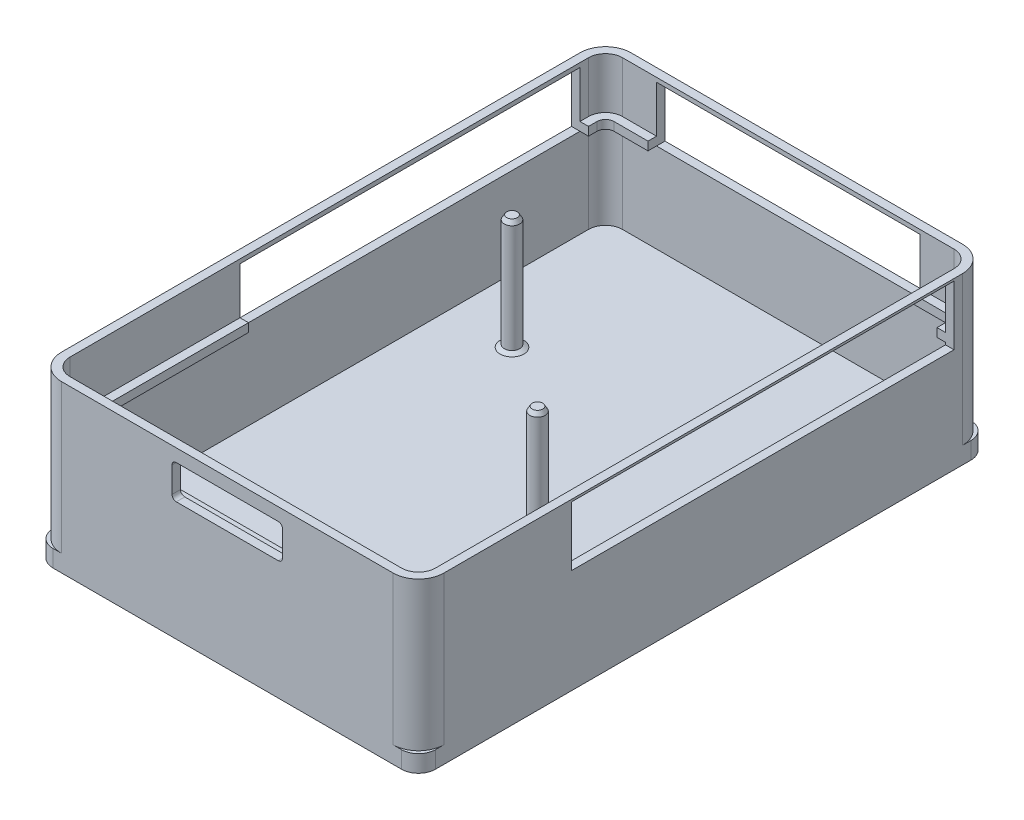
from build123d import *
from OCP.BRepFilletAPI import BRepFilletAPI_MakeChamfer

# Parameters (mm, degrees)
EXTRUDE_1_DEPTH     = 2
EXTRUDE_2_DEPTH     = 17.5
SKETCH_3_R          = 0.9
EXTRUDE_3_DEPTH     = 13.5
CHAMFER_2_SIZE      = 0.5
CHAMFER_2_SIZE2     = 0.288675135
CHAMFER_3_SIZE      = 0.5
CHAMFER_3_SIZE2     = 0.288675135
CHAMFER_4_SIZE      = 0.5
CHAMFER_4_SIZE2     = 0.288675135
EXTRUDE_5_DEPTH     = 1
CUT_EXTRUDE_1_REACH = 75.318
CUT_EXTRUDE_2_REACH = 61.393
SKETCH_7_W          = 45
SKETCH_7_H          = 7
CUT_EXTRUDE_3_REACH = 61.393
CUT_EXTRUDE_4_REACH = 75.318
SKETCH_9_W          = 31
SKETCH_9_H          = 6.5


with BuildPart() as part:
    # 草图1 → 凸台-拉伸1 (new body)
    with BuildSketch(Plane(origin=(0, 0, 0), x_dir=(1, 0, 0), z_dir=(0, 1, 0))):
        with BuildLine():
            Line((-22.5, 31.5), (-22.5, -31.5))
            ThreePointArc((-22.5, -31.5), (-21.914213562, -32.914213562), (-20.5, -33.5))
            Line((-20.5, -33.5), (20.5, -33.5))
            ThreePointArc((20.5, -33.5), (21.914213562, -32.914213562), (22.5, -31.5))
            Line((22.5, -31.5), (22.5, 31.5))
            ThreePointArc((22.5, 31.5), (21.914213562, 32.914213562), (20.5, 33.5))
            Line((20.5, 33.5), (-20.5, 33.5))
            ThreePointArc((-20.5, 33.5), (-21.914213562, 32.914213562), (-22.5, 31.5))
        make_face()
    extrude(amount=EXTRUDE_1_DEPTH)

    # 草图2 → 凸台-拉伸2 (add)
    with BuildSketch(Plane(origin=(0, 2, 0), x_dir=(1, 0, 0), z_dir=(0, 1, 0))):
        with BuildLine():
            Line((19.5, 33.5), (-19.5, 33.5))
            ThreePointArc((-19.5, 33.5), (-21.621320344, 32.621320344), (-22.5, 30.5))
            Line((-22.5, 30.5), (-22.5, -30.5))
            ThreePointArc((-22.5, -30.5), (-21.621320344, -32.621320344), (-19.5, -33.5))
            Line((-19.5, -33.5), (19.5, -33.5))
            ThreePointArc((19.5, -33.5), (21.621320344, -32.621320344), (22.5, -30.5))
            Line((22.5, -30.5), (22.5, 30.5))
            ThreePointArc((22.5, 30.5), (21.621320344, 32.621320344), (19.5, 33.5))
        make_face()
        with BuildLine():
            Line((-21.5, 30.5), (-21.5, -30.5))
            ThreePointArc((-21.5, -30.5), (-20.914213562, -31.914213562), (-19.5, -32.5))
            Line((-19.5, -32.5), (19.5, -32.5))
            ThreePointArc((19.5, -32.5), (20.914213562, -31.914213562), (21.5, -30.5))
            Line((21.5, -30.5), (21.5, 30.5))
            ThreePointArc((21.5, 30.5), (20.914213562, 31.914213562), (19.5, 32.5))
            Line((19.5, 32.5), (-19.5, 32.5))
            ThreePointArc((-19.5, 32.5), (-20.914213562, 31.914213562), (-21.5, 30.5))
        make_face(mode=Mode.SUBTRACT)
    extrude(amount=EXTRUDE_2_DEPTH)

    # 草图3 → 凸台-拉伸3 (add)
    with BuildSketch(Plane(origin=(0, 2, 0), x_dir=(1, 0, 0), z_dir=(0, 1, 0))):
        with Locations(Location((-14, 14, 0), (0, 0, 90))):
            Circle(SKETCH_3_R)
        with Locations(Location((7, -4, 0), (0, 0, 90))):
            Circle(SKETCH_3_R)
        with Locations(Location((-19, -30, 0), (0, 0, 90))):
            Circle(SKETCH_3_R)
    extrude(amount=EXTRUDE_3_DEPTH)

    # 倒角2: one chamfer whose edges measure the first distance from different faces: ONE call of the kernel's chamfer builder (chamfer() names one face for all edges)
    chamfer_2_edges_1 = [part.edges().sort_by_distance(p)[0] for p in [
        (-14, 2, -13.1),
    ]]
    chamfer_2_side_1 = [part.faces().sort_by_distance(p)[0] for p in [
        (0.023765643, 2, -0.018281264),
    ]]
    chamfer_2_edges_2 = [part.edges().sort_by_distance(p)[0] for p in [
        (-14, 15.5, -13.1),
    ]]
    chamfer_2_side_2 = [part.faces().sort_by_distance(p)[0] for p in [
        (-14, 8.75, -13.1),
    ]]
    chamfer_2 = BRepFilletAPI_MakeChamfer(part.part.solid().wrapped)
    for e in chamfer_2_edges_1:
        chamfer_2.Add(CHAMFER_2_SIZE, CHAMFER_2_SIZE2, e.wrapped, chamfer_2_side_1[0].wrapped)  # the first distance lies on this face
    for e in chamfer_2_edges_2:
        chamfer_2.Add(CHAMFER_2_SIZE, CHAMFER_2_SIZE2, e.wrapped, chamfer_2_side_2[0].wrapped)  # the first distance lies on this face
    add(Compound.cast(chamfer_2.Shape()), mode=Mode.REPLACE)

    # 倒角3: one chamfer whose edges measure the first distance from different faces: ONE call of the kernel's chamfer builder (chamfer() names one face for all edges)
    chamfer_3_edges_1 = [part.edges().sort_by_distance(p)[0] for p in [
        (7, 2, 4.9),
    ]]
    chamfer_3_side_1 = [part.faces().sort_by_distance(p)[0] for p in [
        (0.04198855, 2, -0.000112994),
    ]]
    chamfer_3_edges_2 = [part.edges().sort_by_distance(p)[0] for p in [
        (7, 15.5, 4.9),
    ]]
    chamfer_3_side_2 = [part.faces().sort_by_distance(p)[0] for p in [
        (7, 8.75, 4.9),
    ]]
    chamfer_3 = BRepFilletAPI_MakeChamfer(part.part.solid().wrapped)
    for e in chamfer_3_edges_1:
        chamfer_3.Add(CHAMFER_3_SIZE, CHAMFER_3_SIZE2, e.wrapped, chamfer_3_side_1[0].wrapped)  # the first distance lies on this face
    for e in chamfer_3_edges_2:
        chamfer_3.Add(CHAMFER_3_SIZE, CHAMFER_3_SIZE2, e.wrapped, chamfer_3_side_2[0].wrapped)  # the first distance lies on this face
    add(Compound.cast(chamfer_3.Shape()), mode=Mode.REPLACE)

    # 倒角4: one chamfer whose edges measure the first distance from different faces: ONE call of the kernel's chamfer builder (chamfer() names one face for all edges)
    chamfer_4_edges_1 = [part.edges().sort_by_distance(p)[0] for p in [
        (-19, 2, 30.9),
    ]]
    chamfer_4_side_1 = [part.faces().sort_by_distance(p)[0] for p in [
        (-19, 8.75, 30.9),
    ]]
    chamfer_4_edges_2 = [part.edges().sort_by_distance(p)[0] for p in [
        (-19, 15.5, 30.9),
    ]]
    chamfer_4_side_2 = [part.faces().sort_by_distance(p)[0] for p in [
        (-19, 15.5, 30),
    ]]
    chamfer_4 = BRepFilletAPI_MakeChamfer(part.part.solid().wrapped)
    for e in chamfer_4_edges_1:
        chamfer_4.Add(CHAMFER_4_SIZE, CHAMFER_4_SIZE2, e.wrapped, chamfer_4_side_1[0].wrapped)  # the first distance lies on this face
    for e in chamfer_4_edges_2:
        chamfer_4.Add(CHAMFER_4_SIZE, CHAMFER_4_SIZE2, e.wrapped, chamfer_4_side_2[0].wrapped)  # the first distance lies on this face
    add(Compound.cast(chamfer_4.Shape()), mode=Mode.REPLACE)

    # 草图6 → 凸台-拉伸5 (add)
    with BuildSketch(Plane(origin=(0, 12.5, 0), x_dir=(1, 0, 0), z_dir=(0, 1, 0))):
        with BuildLine():
            Line((-21.5, 30.5), (-21.5, -30.5))
            ThreePointArc((-21.5, -30.5), (-20.914213562, -31.914213562), (-19.5, -32.5))
            Line((-19.5, -32.5), (19.5, -32.5))
            ThreePointArc((19.5, -32.5), (20.914213562, -31.914213562), (21.5, -30.5))
            Line((21.5, -30.5), (21.5, 30.5))
            ThreePointArc((21.5, 30.5), (20.914213562, 31.914213562), (19.5, 32.5))
            Line((19.5, 32.5), (-19.5, 32.5))
            ThreePointArc((-19.5, 32.5), (-20.914213562, 31.914213562), (-21.5, 30.5))
        make_face()
        with BuildLine():
            Line((19.5, 31.5), (-19.5, 31.5))
            ThreePointArc((-19.5, 31.5), (-20.207106781, 31.207106781), (-20.5, 30.5))
            Line((-20.5, 30.5), (-20.5, -30.5))
            ThreePointArc((-20.5, -30.5), (-20.207106781, -31.207106781), (-19.5, -31.5))
            Line((-19.5, -31.5), (19.5, -31.5))
            ThreePointArc((19.5, -31.5), (20.207106781, -31.207106781), (20.5, -30.5))
            Line((20.5, -30.5), (20.5, 30.5))
            ThreePointArc((20.5, 30.5), (20.207106781, 31.207106781), (19.5, 31.5))
        make_face(mode=Mode.SUBTRACT)
    extrude(amount=EXTRUDE_5_DEPTH)

    # 草图4 → 切除-拉伸1 (cut, up to next)
    with BuildSketch(Plane.XY.offset(33.5), mode=Mode.PRIVATE) as cut_extrude_1_sk1:
        with BuildLine():
            Line((-6.5, 17.5), (-6.5, 14.5))
            ThreePointArc((-6.5, 14.5), (-6.353553391, 14.146446609), (-6, 14))
            Line((-6, 14), (6, 14))
            ThreePointArc((6, 14), (6.353553391, 14.146446609), (6.5, 14.5))
            Line((6.5, 14.5), (6.5, 17.5))
            ThreePointArc((6.5, 17.5), (6.353553391, 17.853553391), (6, 18))
            Line((6, 18), (-6, 18))
            ThreePointArc((-6, 18), (-6.353553391, 17.853553391), (-6.5, 17.5))
        make_face()
    cut_extrude_1_tool1 = extrude(cut_extrude_1_sk1.sketch, amount=-CUT_EXTRUDE_1_REACH, mode=Mode.PRIVATE) & part.part
    add(cut_extrude_1_tool1.solids().sort_by_distance((0, 16, 33.5))[0], mode=Mode.SUBTRACT)

    # 草图7 → 切除-拉伸2 (cut, up to next)
    with BuildSketch(Plane(origin=(22.5, 0, 0), x_dir=(0, 0, -1), z_dir=(1, 0, 0)), mode=Mode.PRIVATE) as cut_extrude_2_sk1:
        with Locations((7, 15.73884151)):
            Rectangle(SKETCH_7_W, SKETCH_7_H)
    cut_extrude_2_tool1 = extrude(cut_extrude_2_sk1.sketch, amount=-CUT_EXTRUDE_2_REACH, mode=Mode.PRIVATE) & part.part
    add(cut_extrude_2_tool1.solids().sort_by_distance((22.5, 15.738842, -7))[0], mode=Mode.SUBTRACT)

    # 草图8 → 切除-拉伸3 (cut, up to next)
    with BuildSketch(Plane.ZY.offset(22.5), mode=Mode.PRIVATE) as cut_extrude_3_sk1:
        Polygon((-29.5, 19), (-29.5, 12.5), (10.5, 12.5), (10.5, 15.014135881), (10.5, 19), align=None)
    cut_extrude_3_tool1 = extrude(cut_extrude_3_sk1.sketch, amount=-CUT_EXTRUDE_3_REACH, mode=Mode.PRIVATE) & part.part
    add(cut_extrude_3_tool1.solids().sort_by_distance((-22.5, 15.75, -9.5))[0], mode=Mode.SUBTRACT)

    # 草图9 → 切除-拉伸4 (cut, up to next)
    with BuildSketch(Plane(origin=(0, 0, -33.5), x_dir=(-1, 0, 0), z_dir=(0, 0, -1)), mode=Mode.PRIVATE) as cut_extrude_4_sk1:
        with Locations((0, 15.75)):
            Rectangle(SKETCH_9_W, SKETCH_9_H)
    cut_extrude_4_tool1 = extrude(cut_extrude_4_sk1.sketch, amount=-CUT_EXTRUDE_4_REACH, mode=Mode.PRIVATE) & part.part
    add(cut_extrude_4_tool1.solids().sort_by_distance((0, 15.75, -33.5))[0], mode=Mode.SUBTRACT)


solid = part.part
